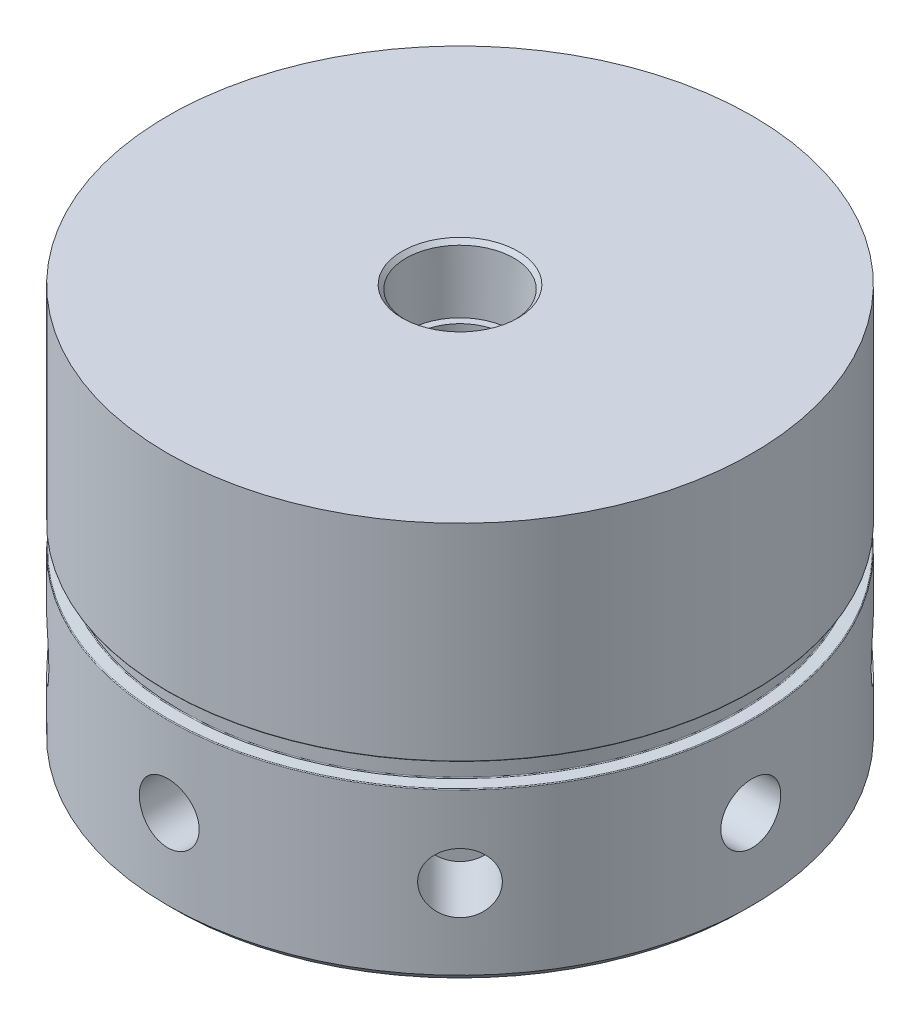
from build123d import *

# Parameters (mm, degrees)
FILLET1_R          = 0.127
FILLET2_R          = 0.127
FILLET3_R          = 0.254
CHAMFER1_SIZE      = 1.27
SKETCH12_R         = 4.7625
CUT_EXTRUDE3_DEPTH = 10.922
CIRPATTERN1_COUNT  = 8


with BuildPart() as part:
    # Sketch1 → Revolve3 (revolve)
    with BuildSketch(Plane.XY, mode=Mode.PRIVATE) as revolve3_sk:
        Polygon((0, -33.404421277), (-46.4693, -33.404421277), (-46.4693, -6.520721208), (-44.4373, -6.414228601), (-44.4373, -2.858228601), (-46.4693, -2.751735993), (-46.4693, 30.095578723), (0, 30.095578723), align=None)
    revolve(revolve3_sk.sketch.rotate(Axis((0, 32.189409805, 0), (0, -1, 0)), 270), axis=Axis((0, 32.189409805, 0), (0, -1, 0)))

    # Fillet1
    fillet1_edges = [part.edges().sort_by_distance(p)[0] for p in [
        (0, -2.751735993, -46.4693),
        (0, -6.520721208, -46.4693),
    ]]
    fillet(fillet1_edges, radius=FILLET1_R)

    # Fillet2
    fillet2_edges = [part.edges().sort_by_distance(p)[0] for p in [
        (0, -2.858228601, -44.4373),
        (0, -6.414228601, -44.4373),
    ]]
    fillet(fillet2_edges, radius=FILLET2_R)

    # Sketch10 → 3/8 NPT Tapped Hole2 (revolve, cut)
    with BuildSketch(Plane(origin=(0, 30.095578723, 0), x_dir=(0, 0, 1), z_dir=(1, 0, 0))):
        Polygon((0, 0), (0, 63.5), (7.1374, 63.5), (7.1374, 10.414), (8.269741561, 10.414), (8.5751162, 0.6323838), (9.2075, 0), align=None)
    revolve(axis=Axis((0, 36.445578723, 0), (0, -1, 0)), mode=Mode.SUBTRACT)

    # Fillet3
    fillet3_edges = [part.edges().sort_by_distance(p)[0] for p in [
        (0, -33.404421277, -7.1374),
    ]]
    fillet(fillet3_edges, radius=FILLET3_R)

    # Chamfer1
    chamfer1_edges = [part.edges().sort_by_distance(p)[0] for p in [
        (0, -33.404421277, -46.4693),
    ]]
    chamfer(chamfer1_edges, length=CHAMFER1_SIZE)

    # Sketch12 → Cut-Extrude3 (cut)
    with BuildSketch(Plane(origin=(-46.4693, 0, 0), x_dir=(0, 0, -1), z_dir=(1, 0, 0))):
        with Locations(Location((0, -19.434421277, 0), (0, 0, 180))):
            Circle(SKETCH12_R)
    cut_extrude3 = extrude(amount=CUT_EXTRUDE3_DEPTH, mode=Mode.SUBTRACT)

    # CirPattern1: Cut-Extrude3 ×8 about axis
    cirpattern1_axis = Axis((0, 0, 0), (0, 1, 0))
    for i in range(1, CIRPATTERN1_COUNT):
        add(cut_extrude3.rotate(cirpattern1_axis, i * 360 / CIRPATTERN1_COUNT), mode=Mode.SUBTRACT)


solid = part.part
